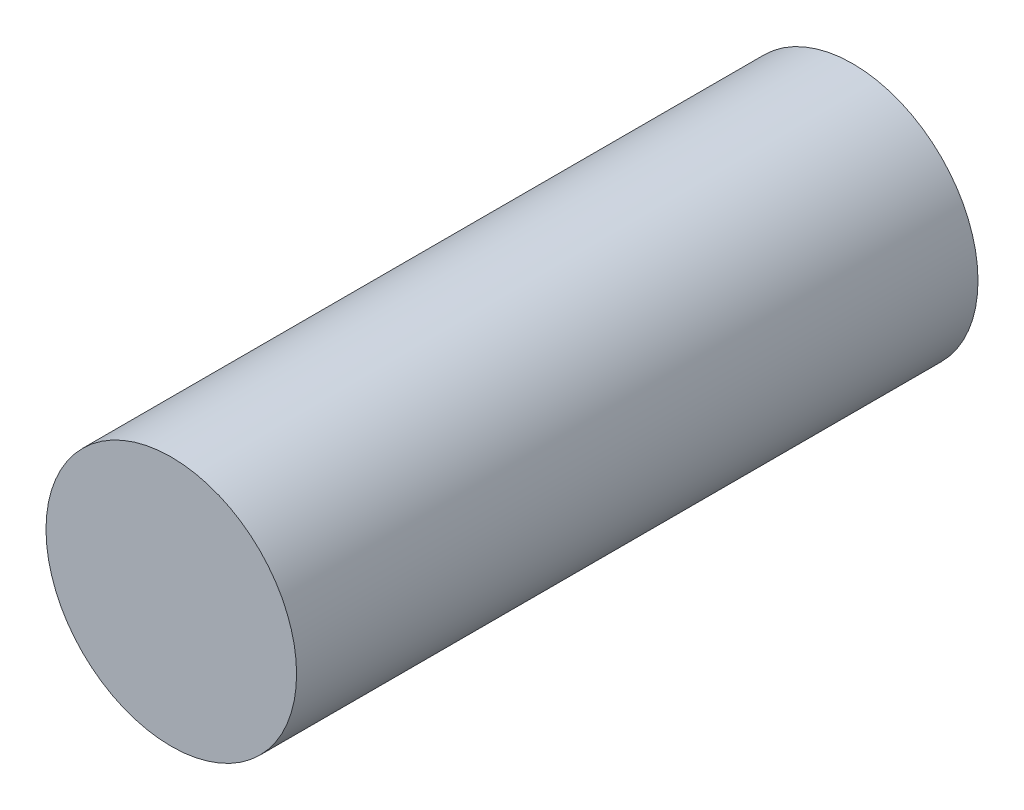
from build123d import *

# Parameters (mm, degrees)
SKETCH1_R      = 7.98
EXTRUDE1_DEPTH = 43.4


with BuildPart() as part:
    # Sketch1 → Extrude1 (new body)
    with BuildSketch(Plane.XY):
        Circle(SKETCH1_R)
    extrude(amount=EXTRUDE1_DEPTH)


solid = part.part
